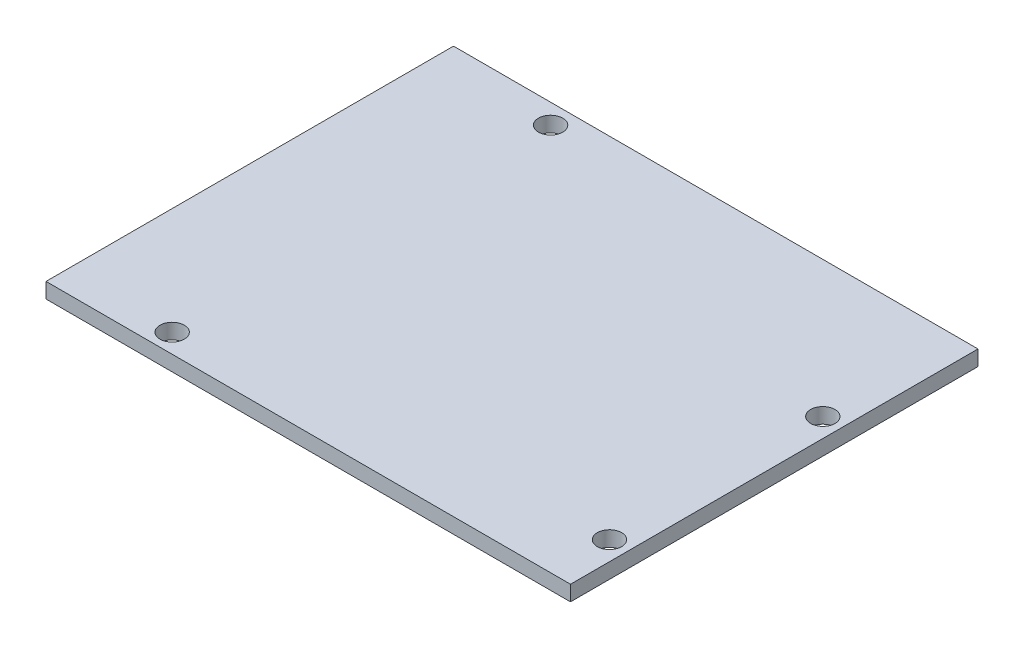
from build123d import *

# Parameters (mm, degrees)
SKETCH1_W           = 68.6
SKETCH1_H           = 53.3
SKETCH1_R           = 1.59
BOSS_EXTRUDE1_DEPTH = 2


with BuildPart() as part:
    # Sketch1 → Boss-Extrude1 (new body)
    with BuildSketch(Plane(origin=(0, 0, 0), x_dir=(1, 0, 0), z_dir=(0, 1, 0))):
        Rectangle(SKETCH1_W, SKETCH1_H)
        with Locations(Location((-20.3, -24.15, 0), (0, 0, 270))):
            Circle(SKETCH1_R, mode=Mode.SUBTRACT)
        with Locations(Location((-19, 24.05, 0), (0, 0, 270))):
            Circle(SKETCH1_R, mode=Mode.SUBTRACT)
        with Locations(Location((31.8, 8.85, 0), (0, 0, 270))):
            Circle(SKETCH1_R, mode=Mode.SUBTRACT)
        with Locations(Location((31.8, -19.05, 0), (0, 0, 270))):
            Circle(SKETCH1_R, mode=Mode.SUBTRACT)
    extrude(amount=BOSS_EXTRUDE1_DEPTH)


solid = part.part
